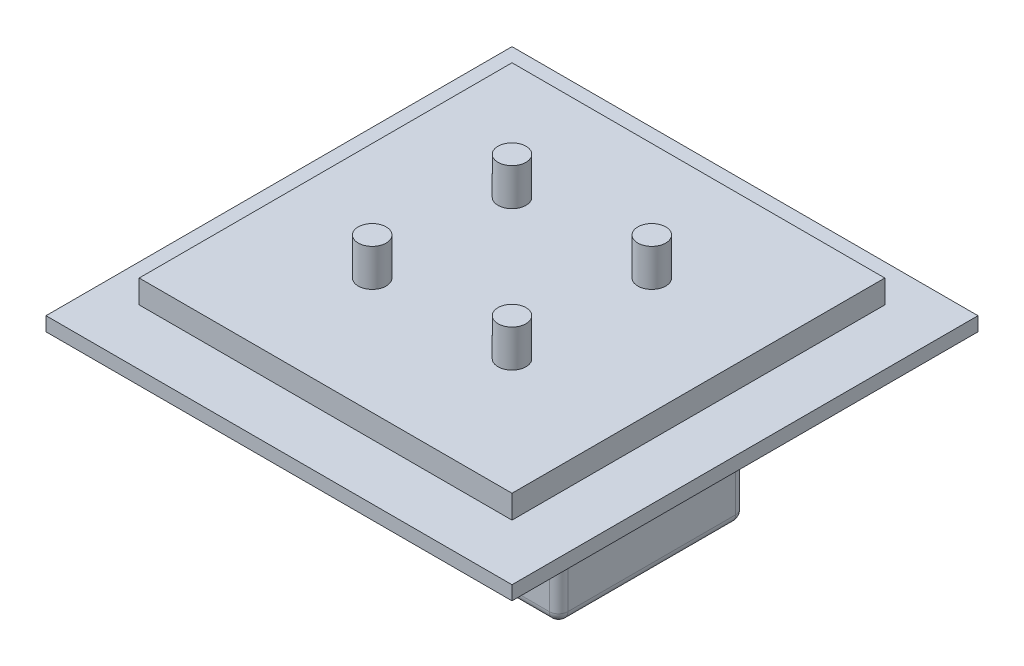
from build123d import *

# Parameters (mm, degrees)
EXTRUDE_1_DEPTH = 100
SKETCH_2_R      = 5
EXTRUDE_2_DEPTH = 2
SKETCH_3_W      = 80
SKETCH_3_H      = 80
EXTRUDE_3_DEPTH = 5
SKETCH_4_R      = 3
EXTRUDE_4_DEPTH = 8
SKETCH_5_W      = 60
SKETCH_5_H      = 40
EXTRUDE_5_DEPTH = 30
FILLET_1_R      = 2


with BuildPart() as part:
    # 草图1 → 凸台-拉伸1 (new body)
    with BuildSketch(Plane.XY):
        Polygon((0, 0), (-50, 0), (-50, 3), (50, 3), (50, 0), align=None)
    extrude(amount=-EXTRUDE_1_DEPTH)

    # 草图2 → 凸台-拉伸2 (add)
    with BuildSketch(Plane(origin=(0, 3, 0), x_dir=(1, 0, 0), z_dir=(0, 1, 0))):
        with Locations(Location((-30, 80, 0), (0, 0, 270))):
            Circle(SKETCH_2_R)
        with Locations(Location((30, 80, 0), (0, 0, 270))):
            Circle(SKETCH_2_R)
        with Locations(Location((-30, 20, 0), (0, 0, 270))):
            Circle(SKETCH_2_R)
        with Locations(Location((30, 20, 0), (0, 0, 270))):
            Circle(SKETCH_2_R)
    extrude(amount=EXTRUDE_2_DEPTH)

    # 草图3 → 凸台-拉伸3 (add)
    with BuildSketch(Plane(origin=(0, 5, 0), x_dir=(1, 0, 0), z_dir=(0, 1, 0))):
        with Locations((0, 50)):
            Rectangle(SKETCH_3_W, SKETCH_3_H)
    extrude(amount=EXTRUDE_3_DEPTH)

    # 草图4 → 凸台-拉伸4 (add)
    with BuildSketch(Plane(origin=(0, 10, 0), x_dir=(1, 0, 0), z_dir=(0, 1, 0))):
        with Locations(Location((-15, 65, 0), (0, 0, 90))):
            Circle(SKETCH_4_R)
        with Locations(Location((15, 65, 0), (0, 0, 90))):
            Circle(SKETCH_4_R)
        with Locations(Location((-15, 35, 0), (0, 0, 90))):
            Circle(SKETCH_4_R)
        with Locations(Location((15, 35, 0), (0, 0, 90))):
            Circle(SKETCH_4_R)
    extrude(amount=EXTRUDE_4_DEPTH)

    # 草图5 → 凸台-拉伸5 (add)
    with BuildSketch(Plane.XZ):
        with Locations((0, -50)):
            Rectangle(SKETCH_5_W, SKETCH_5_H)
    extrude(amount=EXTRUDE_5_DEPTH)

    # 圆角1
    fillet_1_edges = [part.edges().sort_by_distance(p)[0] for p in [
        (30, -15, -70),
        (30, -15, -30),
        (-30, -15, -30),
        (-30, -15, -70),
        (30, -30, -50),
        (0, -30, -30),
        (-30, -30, -50),
        (0, -30, -70),
    ]]
    fillet(fillet_1_edges, radius=FILLET_1_R)


solid = part.part
